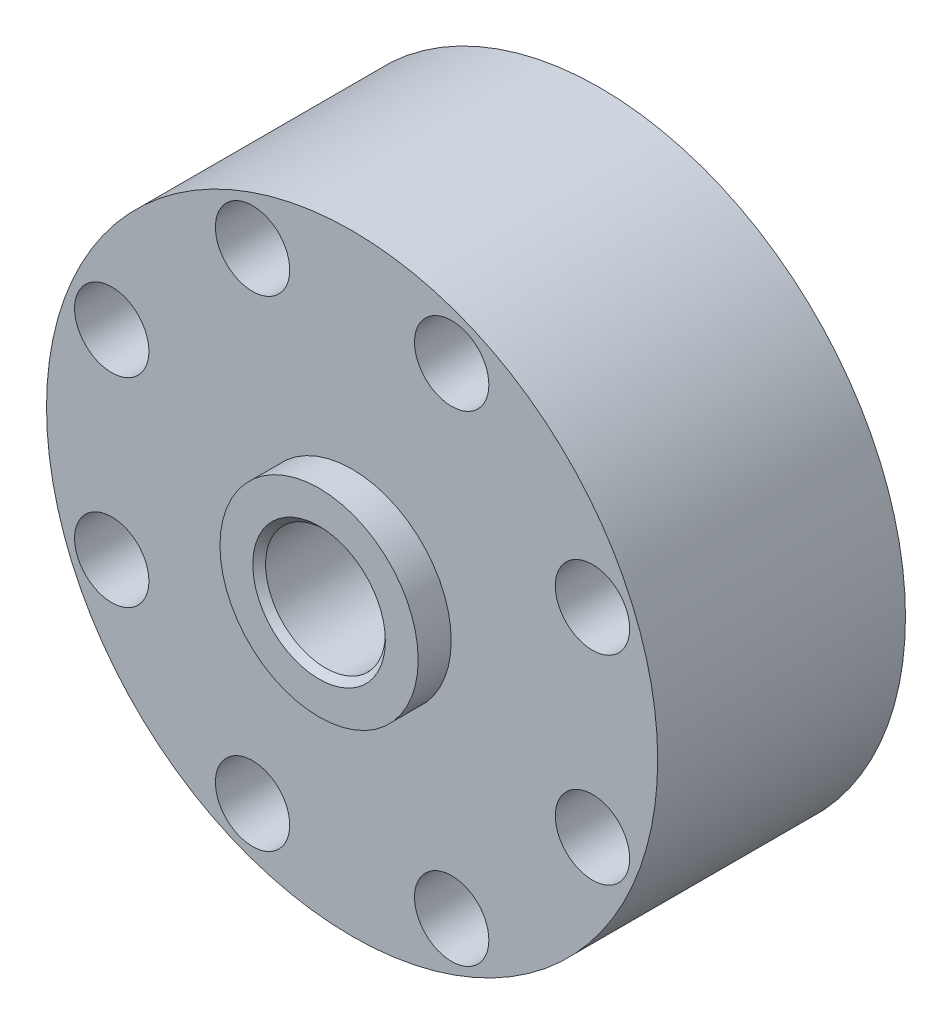
from build123d import *

# Parameters (mm, degrees)
ESBO_O1_R                = 37
RESSALTO_EXTRUS_O1_DEPTH = 30
FURO1_D                  = 6
FURO1_CBORE_D            = 9
FURO1_CBORE_DEPTH        = 7
PADR_OCIRCULAR1_COUNT    = 8
ESBO_O4_R                = 12
RESSALTO_EXTRUS_O2_DEPTH = 4


with BuildPart() as part:
    # Esboço1 → Ressalto-extrusão1 (new body)
    with BuildSketch(Plane.XY):
        Circle(ESBO_O1_R)
    extrude(amount=RESSALTO_EXTRUS_O1_DEPTH)

    # Furo1 (through all)
    with Locations(Plane(origin=(-12.05452812, 29.102205274, 30), x_dir=(1, 0, 0), z_dir=(0, 0, 1))):
        with Locations((0, 0)):
            furo1 = CounterBoreHole(FURO1_D / 2, FURO1_CBORE_D / 2, FURO1_CBORE_DEPTH)

    # PadrãoCircular1: Furo1 ×8 about axis
    padr_ocircular1_axis = Axis((0, 0, 30), (0, 0, 1))
    for i in range(1, PADR_OCIRCULAR1_COUNT):
        add(furo1.rotate(padr_ocircular1_axis, i * 360 / PADR_OCIRCULAR1_COUNT), mode=Mode.SUBTRACT)

    # Esboço4 → Ressalto-extrusão2 (add)
    with BuildSketch(Plane.XY.offset(30)):
        Circle(ESBO_O4_R)
    extrude(amount=RESSALTO_EXTRUS_O2_DEPTH)

    # Esboço7 → Furo roscado de M16x1.51 (revolve, cut)
    with BuildSketch(Plane(origin=(0, 0, 34), x_dir=(0, -1, 0), z_dir=(1, 0, 0))):
        Polygon((0, 0), (0, 34), (8.025, 34), (7.25, 33.225), (7.25, 0.775), (8.025, 0), align=None)
    revolve(axis=Axis((0, 0, 40.35), (0, 0, -1)), mode=Mode.SUBTRACT)


solid = part.part
